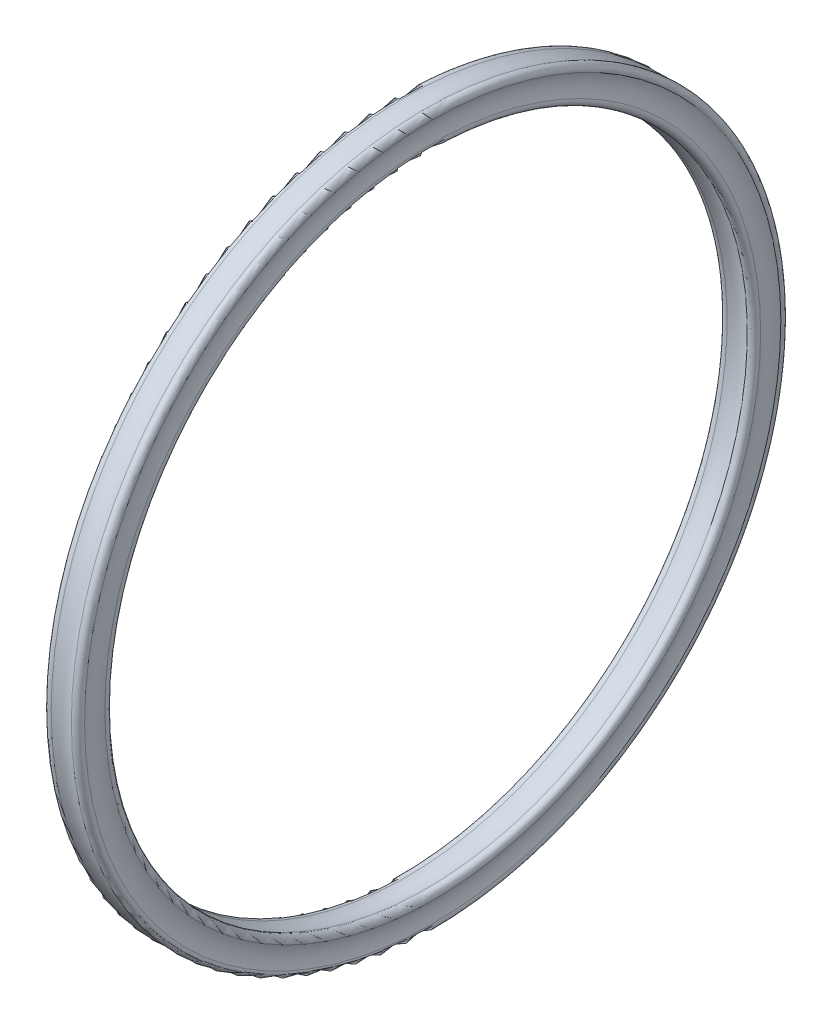
from build123d import *


with BuildPart() as part:
    # Sketch1 → Revolve1 (revolve)
    with BuildSketch(Plane.XY, mode=Mode.PRIVATE) as revolve1_sk:
        with BuildLine():
            ThreePointArc((-1.275102846, 26.525016306), (-1.111885, 25.7556), (-1.275102846, 24.986183694))
            ThreePointArc((-1.275102846, 24.986183694), (-1.195882761, 24.559717239), (-0.769416306, 24.480497154))
            ThreePointArc((-0.769416306, 24.480497154), (0, 24.643715), (0.769416306, 24.480497154))
            ThreePointArc((0.769416306, 24.480497154), (1.195882761, 24.559717239), (1.275102846, 24.986183694))
            ThreePointArc((1.275102846, 24.986183694), (1.111885, 25.7556), (1.275102846, 26.525016306))
            ThreePointArc((1.275102846, 26.525016306), (1.195882761, 26.951482761), (0.769416306, 27.030702846))
            ThreePointArc((0.769416306, 27.030702846), (0, 26.867485), (-0.769416306, 27.030702846))
            ThreePointArc((-0.769416306, 27.030702846), (-1.195882761, 26.951482761), (-1.275102846, 26.525016306))
        make_face()
    revolve(revolve1_sk.sketch.rotate(Axis((-1.3081, 0, 0), (1, 0, 0)), 90), axis=Axis((-1.3081, 0, 0), (1, 0, 0)))


solid = part.part
